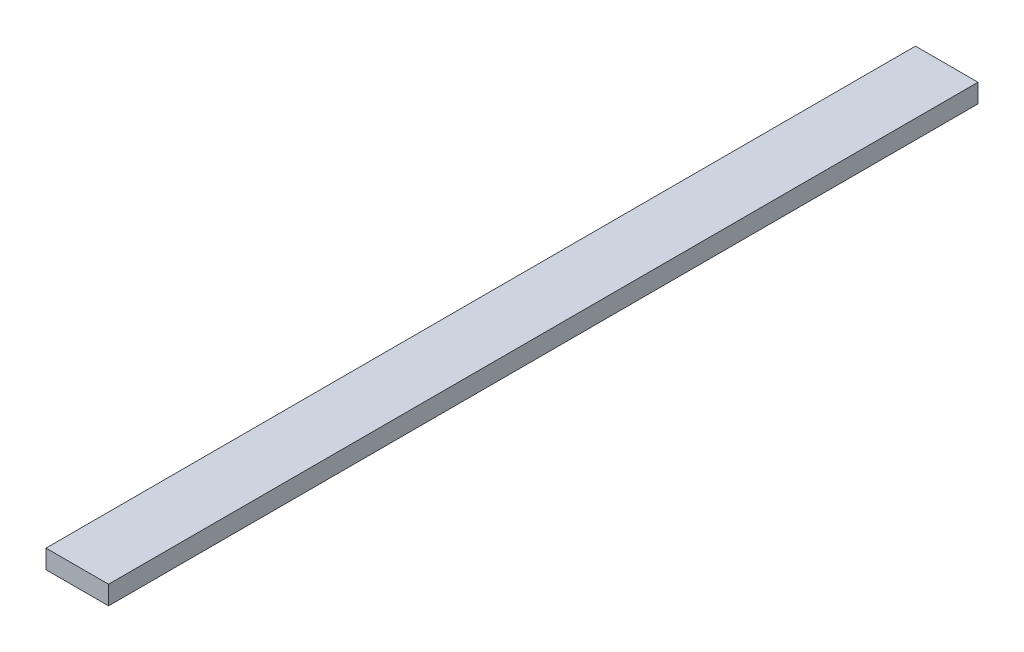
from build123d import *

# Parameters (mm, degrees)
SKETCH1_W           = 10
SKETCH1_H           = 139
BOSS_EXTRUDE1_DEPTH = 3


with BuildPart() as part:
    # Sketch1 → Boss-Extrude1 (new body)
    with BuildSketch(Plane.XZ.offset(16.3)):
        with Locations((-23.367832778, -12.28)):
            Rectangle(SKETCH1_W, SKETCH1_H)
    extrude(amount=-BOSS_EXTRUDE1_DEPTH)


solid = part.part
